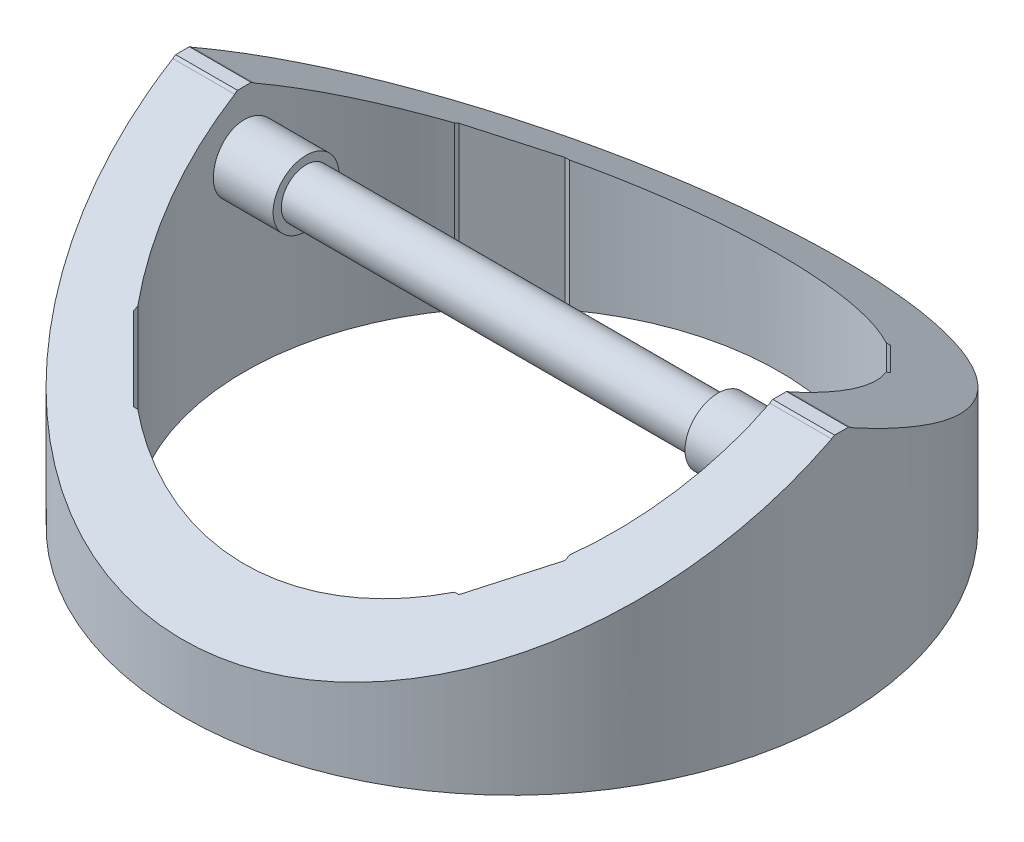
from build123d import *

# Parameters (mm, degrees)
ESQUISSE2_R             = 400
BOSS_EXTRU_1_DEPTH      = 300
ENL_V_MAT_EXTRU_1_DEPTH = 575
ENL_V_START             = 705
ENL_V_MAT_EXTRU_2_DEPTH = 705
ESQUISSE9_R             = 40
BOSS_EXTRU_10_DEPTH     = 350
BOSS_EXTRU_11_START     = -350
ESQUISSE9_4_R           = 40
BOSS_EXTRU_11_DEPTH     = 350
ENL_V_START_2           = -250
ESQUISSE10_R            = 40
ESQUISSE10_R_2          = 30
ENL_V_MAT_EXTRU_3_DEPTH = 250
ESQUISSE10_2_R          = 40
ESQUISSE10_2_R_2        = 30
ENL_V_MAT_EXTRU_4_DEPTH = 250


with BuildPart() as part:
    # Esquisse2 → Boss.-Extru.1 (new body)
    with BuildSketch(Plane(origin=(0, 0, 0), x_dir=(1, 0, 0), z_dir=(0, 1, 0))):
        Circle(ESQUISSE2_R)
        with BuildLine():
            Line((-262.027957955, 192.26634976), (-262.027957955, 197.591449816))
            Line((-262.027957955, 197.591449816), (-229.809703961, 229.80970381))
            Line((-229.809703961, 229.80970381), (-197.591449816, 262.027957955))
            Line((-197.591449816, 262.027957955), (-192.26634976, 262.027957955))
            ThreePointArc((-192.26634976, 262.027957955), (0, 325), (192.26634976, 262.027957955))
            Line((192.26634976, 262.027957955), (197.591449816, 262.027957955))
            Line((197.591449816, 262.027957955), (229.809703566, 229.809704205))
            Line((229.809703566, 229.809704205), (262.027957955, 197.591449816))
            Line((262.027957955, 197.591449816), (262.027957955, 192.26634976))
            ThreePointArc((262.027957955, 192.26634976), (308.856023363, 101.158078433), (325, 0))
            ThreePointArc((325, 0), (308.856023363, -101.158078433), (262.027957955, -192.26634976))
            Line((262.027957955, -192.26634976), (262.027957955, -197.591449816))
            Line((262.027957955, -197.591449816), (229.809704204, -229.809703567))
            Line((229.809704204, -229.809703567), (197.591449816, -262.027957955))
            Line((197.591449816, -262.027957955), (192.26634976, -262.027957955))
            ThreePointArc((192.26634976, -262.027957955), (0, -325), (-192.26634976, -262.027957955))
            Line((-192.26634976, -262.027957955), (-197.591449816, -262.027957955))
            Line((-197.591449816, -262.027957955), (-229.809704607, -229.809703164))
            Line((-229.809704607, -229.809703164), (-262.027957955, -197.591449816))
            Line((-262.027957955, -197.591449816), (-262.027957955, -192.26634976))
            ThreePointArc((-262.027957955, -192.26634976), (-325, 0), (-262.027957955, 192.26634976))
        make_face(mode=Mode.SUBTRACT)
    extrude(amount=BOSS_EXTRU_1_DEPTH)

    # Esquisse3 → Enlèv. mat.-Extru.1 (cut)
    with BuildSketch(Plane(origin=(0, 0, 0), x_dir=(0, 0, -1), z_dir=(1, 0, 0))):
        with BuildLine():
            Line((400, 300.833333333), (4.166666667, 300.833333333))
            ThreePointArc((4.166666667, 300.833333333), (8.312403851, 300.008694936), (11.82699013, 297.660323463))
            Line((11.82699013, 297.660323463), (400, 80.833333333))
            Line((400, 80.833333333), (400, 300.833333333))
        make_face()
        with BuildLine():
            ThreePointArc((-11.82699013, 297.660323463), (-8.312403851, 300.008694936), (-4.166666667, 300.833333333))
            Line((-4.166666667, 300.833333333), (-400, 300.833333333))
            Line((-400, 300.833333333), (-400, 80.833333333))
            Line((-400, 80.833333333), (-11.82699013, 297.660323463))
        make_face()
    extrude(amount=-ENL_V_MAT_EXTRU_1_DEPTH, mode=Mode.SUBTRACT)

    # Esquisse3<3> → Enlèv. mat.-Extru.2 (cut)
    with BuildSketch(Plane(origin=(0, 0, 0), x_dir=(0, 0, -1), z_dir=(1, 0, 0)).offset(ENL_V_START)):
        with BuildLine():
            Line((400, 300.833333333), (4.166666667, 300.833333333))
            ThreePointArc((4.166666667, 300.833333333), (8.312403851, 300.008694936), (11.82699013, 297.660323463))
            Line((11.82699013, 297.660323463), (400, 80.833333333))
            Line((400, 80.833333333), (400, 300.833333333))
        make_face()
        with BuildLine():
            ThreePointArc((-11.82699013, 297.660323463), (-8.312403851, 300.008694936), (-4.166666667, 300.833333333))
            Line((-4.166666667, 300.833333333), (-400, 300.833333333))
            Line((-400, 300.833333333), (-400, 80.833333333))
            Line((-400, 80.833333333), (-11.82699013, 297.660323463))
        make_face()
    extrude(amount=-ENL_V_MAT_EXTRU_2_DEPTH, mode=Mode.SUBTRACT)

    # Esquisse9 → Boss.-Extru.10 (add)
    with BuildSketch(Plane(origin=(0, 0, 0), x_dir=(0, 0, -1), z_dir=(1, 0, 0))):
        with Locations((0, 225)):
            Circle(ESQUISSE9_R)
    extrude(amount=BOSS_EXTRU_10_DEPTH)

    # Esquisse9<4> → Boss.-Extru.11 (add)
    with BuildSketch(Plane(origin=(0, 0, 0), x_dir=(0, 0, -1), z_dir=(1, 0, 0)).offset(BOSS_EXTRU_11_START)):
        with Locations((0, 225)):
            Circle(ESQUISSE9_4_R)
    extrude(amount=BOSS_EXTRU_11_DEPTH)

    # Esquisse10 → Enlèv. mat.-Extru.3 (cut)
    with BuildSketch(Plane(origin=(0, 0, 0), x_dir=(0, 0, -1), z_dir=(1, 0, 0)).offset(ENL_V_START_2)):
        with Locations((0, 225)):
            Circle(ESQUISSE10_R)
        with Locations((0, 225)):
            Circle(ESQUISSE10_R_2, mode=Mode.SUBTRACT)
    extrude(amount=ENL_V_MAT_EXTRU_3_DEPTH, mode=Mode.SUBTRACT)

    # Esquisse10<2> → Enlèv. mat.-Extru.4 (cut)
    with BuildSketch(Plane(origin=(0, 0, 0), x_dir=(0, 0, -1), z_dir=(1, 0, 0))):
        with Locations((0, 225)):
            Circle(ESQUISSE10_2_R)
        with Locations((0, 225)):
            Circle(ESQUISSE10_2_R_2, mode=Mode.SUBTRACT)
    extrude(amount=ENL_V_MAT_EXTRU_4_DEPTH, mode=Mode.SUBTRACT)


solid = part.part
